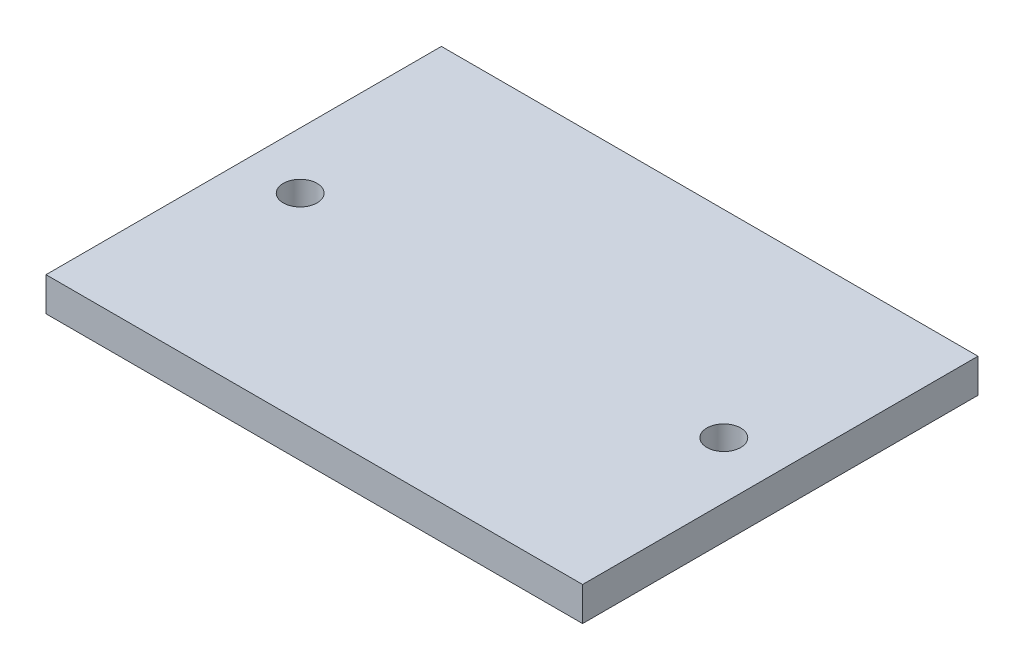
from build123d import *

# Parameters (mm, degrees)
SKETCH1_W             = 47.5
SKETCH1_H             = 35
BOSS_EXTRUDE1_DEPTH   = 3
F_3_0MM_DOWEL_HOLE1_D = 3


with BuildPart() as part:
    # Sketch1 → Boss-Extrude1 (new body)
    with BuildSketch(Plane(origin=(0, 0, 0), x_dir=(1, 0, 0), z_dir=(0, 1, 0))):
        with Locations((23.75, 17.5)):
            Rectangle(SKETCH1_W, SKETCH1_H)
    extrude(amount=BOSS_EXTRUDE1_DEPTH)

    # Ø3.0mm Dowel Hole1 (through all)
    with Locations(Plane(origin=(0, 3, 0), x_dir=(1, 0, 0), z_dir=(0, 1, 0))):
        with Locations((5, 17.5), (42.5, 17.5)):
            Hole(F_3_0MM_DOWEL_HOLE1_D / 2)


solid = part.part
